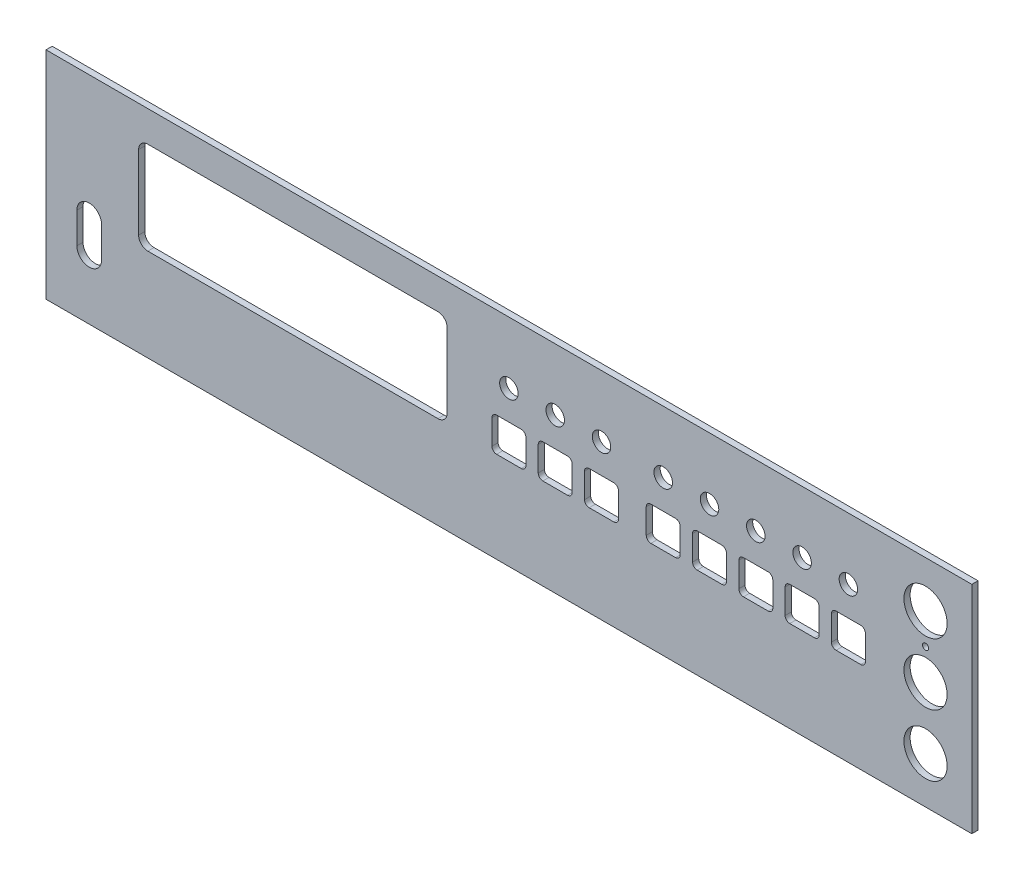
from build123d import *

# Parameters (mm, degrees)
SKETCH_1_W          = 300
SKETCH_1_H          = 70
SKETCH_1_R          = 7
SKETCH_1_R_2        = 3
SKETCH_1_W_2        = 100
SKETCH_1_H_2        = 30
SKETCH_1_W_3        = 11
SKETCH_1_H_3        = 11
EXTRUDE_1_DEPTH     = 2
FILLET_1_R          = 1.5
FILLET_2_R          = 3
SKETCH_2_R          = 1
CUT_EXTRUDE_1_DEPTH = 155.04220201


with BuildPart() as part:
    # Эскиз1 → Бобышка-Вытянуть1 (new body)
    with BuildSketch(Plane.XY):
        Rectangle(SKETCH_1_W, SKETCH_1_H)
        with Locations((135, 20)):
            Circle(SKETCH_1_R, mode=Mode.SUBTRACT)
        with Locations((135, 0)):
            Circle(SKETCH_1_R, mode=Mode.SUBTRACT)
        with Locations((135, -20)):
            Circle(SKETCH_1_R, mode=Mode.SUBTRACT)
        with Locations((110, 15)):
            Circle(SKETCH_1_R_2, mode=Mode.SUBTRACT)
        with Locations((95, 15)):
            Circle(SKETCH_1_R_2, mode=Mode.SUBTRACT)
        with Locations((80, 15)):
            Circle(SKETCH_1_R_2, mode=Mode.SUBTRACT)
        with Locations((65, 15)):
            Circle(SKETCH_1_R_2, mode=Mode.SUBTRACT)
        with Locations((50, 15)):
            Circle(SKETCH_1_R_2, mode=Mode.SUBTRACT)
        with Locations((30, 15)):
            Circle(SKETCH_1_R_2, mode=Mode.SUBTRACT)
        with Locations((15, 15)):
            Circle(SKETCH_1_R_2, mode=Mode.SUBTRACT)
        with Locations((0, 15)):
            Circle(SKETCH_1_R_2, mode=Mode.SUBTRACT)
        with Locations((-70, 10)):
            Rectangle(SKETCH_1_W_2, SKETCH_1_H_2, mode=Mode.SUBTRACT)
        with Locations((65, 0)):
            Rectangle(SKETCH_1_W_3, SKETCH_1_H_3, mode=Mode.SUBTRACT)
        with Locations((80, 0)):
            Rectangle(SKETCH_1_W_3, SKETCH_1_H_3, mode=Mode.SUBTRACT)
        with Locations((95, 0)):
            Rectangle(SKETCH_1_W_3, SKETCH_1_H_3, mode=Mode.SUBTRACT)
        with Locations((110, 0)):
            Rectangle(SKETCH_1_W_3, SKETCH_1_H_3, mode=Mode.SUBTRACT)
        with Locations((50, 0)):
            Rectangle(SKETCH_1_W_3, SKETCH_1_H_3, mode=Mode.SUBTRACT)
        with Locations((15, 0)):
            Rectangle(SKETCH_1_W_3, SKETCH_1_H_3, mode=Mode.SUBTRACT)
        with Locations((30, 0)):
            Rectangle(SKETCH_1_W_3, SKETCH_1_H_3, mode=Mode.SUBTRACT)
        Rectangle(SKETCH_1_W_3, SKETCH_1_H_3, mode=Mode.SUBTRACT)
        with BuildLine():
            Line((-140, -5), (-140, -15))
            ThreePointArc((-140, -15), (-136, -19), (-132, -15))
            Line((-132, -15), (-132, -5))
            ThreePointArc((-132, -5), (-136, -1), (-140, -5))
        make_face(mode=Mode.SUBTRACT)
    extrude(amount=-EXTRUDE_1_DEPTH)

    # Скругление1
    fillet_1_edges = [part.edges().sort_by_distance(p)[0] for p in [
        (20.5, -5.5, -1),
        (9.5, -5.5, -1),
        (9.5, 5.5, -1),
        (20.5, 5.5, -1),
        (24.5, -5.5, -1),
        (24.5, 5.5, -1),
        (35.5, 5.5, -1),
        (35.5, -5.5, -1),
        (5.5, -5.5, -1),
        (-5.5, -5.5, -1),
        (-5.5, 5.5, -1),
        (5.5, 5.5, -1),
        (59.5, 5.5, -1),
        (70.5, 5.5, -1),
        (70.5, -5.5, -1),
        (59.5, -5.5, -1),
        (74.5, -5.5, -1),
        (74.5, 5.5, -1),
        (85.5, 5.5, -1),
        (85.5, -5.5, -1),
        (89.5, 5.5, -1),
        (100.5, 5.5, -1),
        (100.5, -5.5, -1),
        (89.5, -5.5, -1),
        (104.5, 5.5, -1),
        (115.5, 5.5, -1),
        (115.5, -5.5, -1),
        (104.5, -5.5, -1),
        (44.5, -5.5, -1),
        (44.5, 5.5, -1),
        (55.5, 5.5, -1),
        (55.5, -5.5, -1),
    ]]
    fillet(fillet_1_edges, radius=FILLET_1_R)

    # Скругление2
    fillet_2_edges = [part.edges().sort_by_distance(p)[0] for p in [
        (-120, 25, -1),
        (-20, 25, -1),
        (-20, -5, -1),
        (-120, -5, -1),
    ]]
    fillet(fillet_2_edges, radius=FILLET_2_R)

    # Эскиз2 → Вырез-Вытянуть1 (cut, through all)
    with BuildSketch(Plane.XY):
        with Locations((135, 10)):
            Circle(SKETCH_2_R)
    extrude(amount=-CUT_EXTRUDE_1_DEPTH, mode=Mode.SUBTRACT)


solid = part.part
